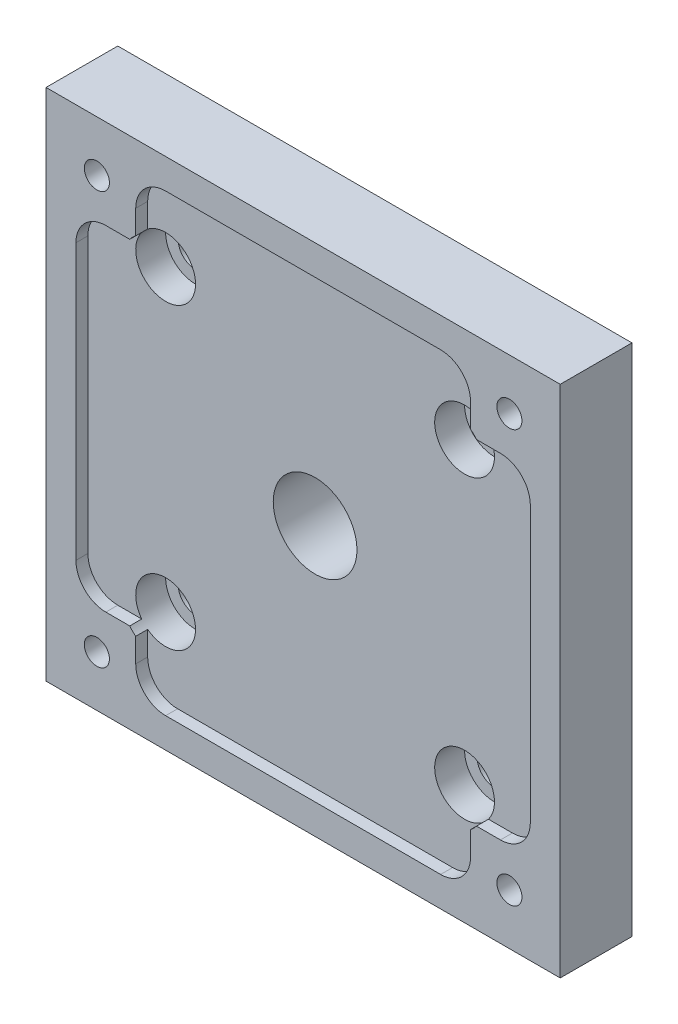
from build123d import *

# Parameters (mm, degrees)
SKETCH_1_W                     = 86
SKETCH_1_H                     = 86
EXTRUDE_1_DEPTH                = 12
CUT_EXTRUDE_1_DEPTH            = 2
SKETCH_3_R                     = 7
CUT_EXTRUDE_2_DEPTH            = 123.21292894
HOLE_WIZARD_M5_1_D             = 4.2
FILLET_1_R                     = 5
HOLE_WIZARD_M5_1_2_D           = 5.8
HOLE_WIZARD_M5_1_2_CBORE_D     = 10
HOLE_WIZARD_M5_1_2_CBORE_DEPTH = 7


with BuildPart() as part:
    # 草图1 → 凸台-拉伸1 (new body)
    with BuildSketch(Plane.XY):
        with Locations((43, 43)):
            Rectangle(SKETCH_1_W, SKETCH_1_H)
    extrude(amount=EXTRUDE_1_DEPTH)

    # 草图2 → 切除-拉伸1 (cut)
    with BuildSketch(Plane.XY.offset(12)):
        Polygon((71, 81), (15, 81), (15, 71), (5, 71), (5, 15), (15, 15), (15, 5), (71, 5), (71, 15), (81, 15), (81, 71), (71, 71), align=None)
    extrude(amount=-CUT_EXTRUDE_1_DEPTH, mode=Mode.SUBTRACT)

    # 草图3 → 切除-拉伸2 (cut, through all)
    with BuildSketch(Plane(origin=(0, 0, 0), x_dir=(-1, 0, 0), z_dir=(0, 0, -1))):
        with Locations((-43, 43)):
            Circle(SKETCH_3_R)
    extrude(amount=-CUT_EXTRUDE_2_DEPTH, mode=Mode.SUBTRACT)

    # Hole Wizard M5 _1 (through all)
    with Locations(Plane.XY.offset(12)):
        with Locations((77.5, 77.5), (8.5, 77.5), (8.5, 8.5), (77.5, 8.5)):
            Hole(HOLE_WIZARD_M5_1_D / 2)

    # 圆角1
    fillet_1_edges = [part.edges().sort_by_distance(p)[0] for p in [
        (15, 81, 11),
        (71, 81, 11),
        (81, 71, 11),
        (81, 15, 11),
        (71, 5, 11),
        (15, 5, 11),
        (5, 15, 11),
        (5, 71, 11),
    ]]
    fillet(fillet_1_edges, radius=FILLET_1_R)

    # Hole Wizard M5 _1 2 (through all)
    with Locations(Plane.XY.offset(12)):
        with Locations((18, 68), (68, 68), (18, 18), (68, 18)):
            CounterBoreHole(HOLE_WIZARD_M5_1_2_D / 2, HOLE_WIZARD_M5_1_2_CBORE_D / 2, HOLE_WIZARD_M5_1_2_CBORE_DEPTH)


solid = part.part
